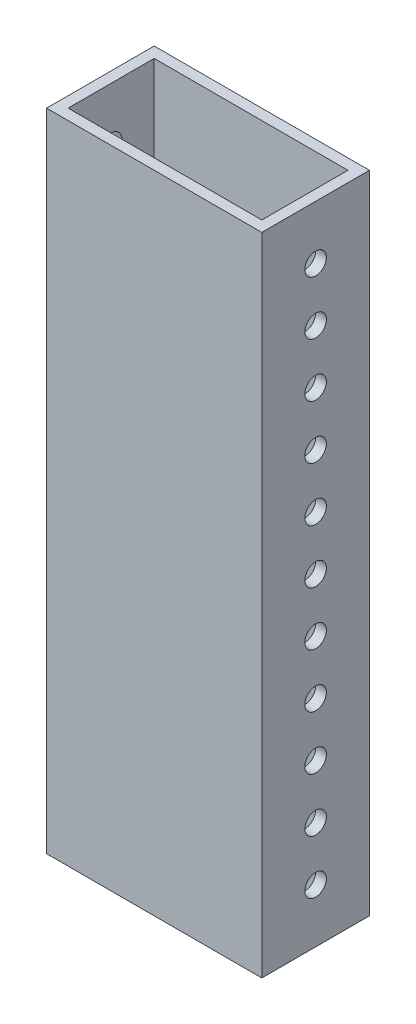
from build123d import *

# Parameters (mm, degrees)
SKETCH1_W           = 50.8
SKETCH1_H           = 25.4
SKETCH1_W_2         = 45.72
SKETCH1_H_2         = 20.32
BOSS_EXTRUDE2_DEPTH = 152.4
SKETCH2_R           = 2.54
CUT_EXTRUDE1_DEPTH  = 127


with BuildPart() as part:
    # Sketch1 → Boss-Extrude2 (new body)
    with BuildSketch(Plane(origin=(0, 0, 0), x_dir=(1, 0, 0), z_dir=(0, 1, 0))):
        with Locations((-34.550728477, 5.021125828)):
            Rectangle(SKETCH1_W, SKETCH1_H)
        with Locations((-34.550728477, 5.021125828)):
            Rectangle(SKETCH1_W_2, SKETCH1_H_2, mode=Mode.SUBTRACT)
    extrude(amount=BOSS_EXTRUDE2_DEPTH)

    # Sketch2 → Cut-Extrude1 (cut)
    with BuildSketch(Plane(origin=(-9.150728477, 0, 0), x_dir=(0, 0, -1), z_dir=(1, 0, 0))):
        with Locations((5.021125828, 139.7)):
            Circle(SKETCH2_R)
        with Locations((5.021125828, 127)):
            Circle(SKETCH2_R)
        with Locations((5.021125828, 114.3)):
            Circle(SKETCH2_R)
        with Locations((5.021125828, 101.6)):
            Circle(SKETCH2_R)
        with Locations((5.021125828, 88.9)):
            Circle(SKETCH2_R)
        with Locations((5.021125828, 76.2)):
            Circle(SKETCH2_R)
        with Locations((5.021125828, 63.5)):
            Circle(SKETCH2_R)
        with Locations((5.021125828, 50.8)):
            Circle(SKETCH2_R)
        with Locations((5.021125828, 38.1)):
            Circle(SKETCH2_R)
        with Locations((5.021125828, 25.4)):
            Circle(SKETCH2_R)
        with Locations((5.021125828, 12.7)):
            Circle(SKETCH2_R)
    extrude(amount=-CUT_EXTRUDE1_DEPTH, mode=Mode.SUBTRACT)


solid = part.part
